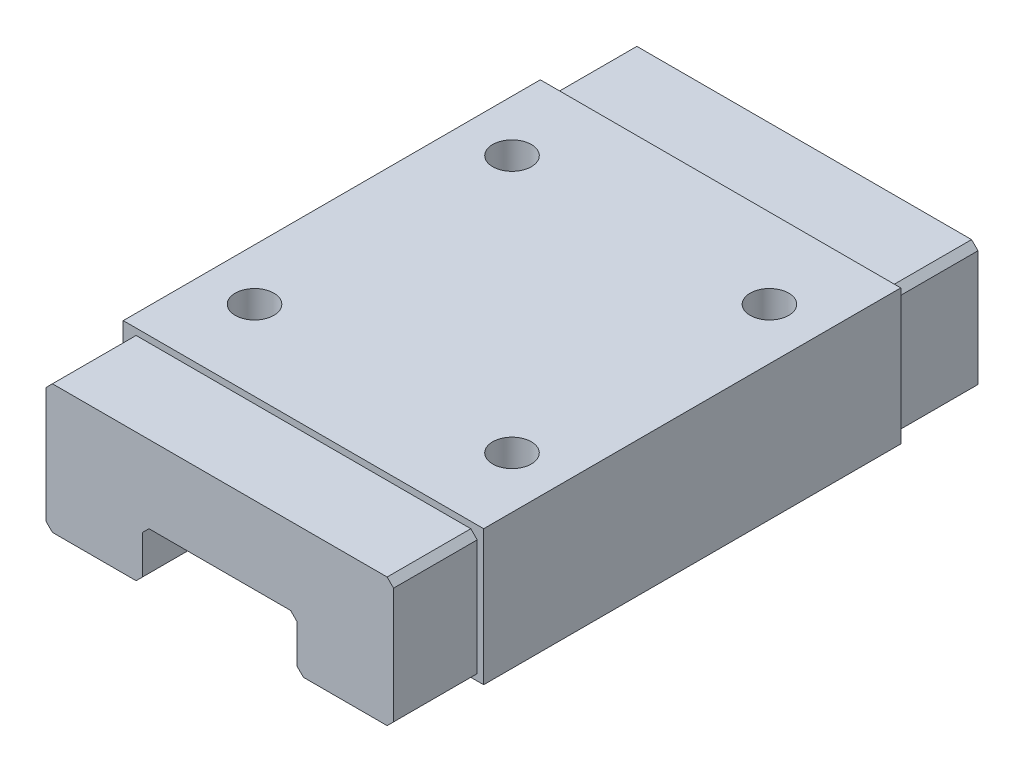
from build123d import *

# Parameters (mm, degrees)
EXTRUDE_1_DEPTH     = 45.4
EXTRUDE_START       = -6.5
EXTRUDE_2_DEPTH     = 32.4
CHAMFER_1_SIZE      = 0.5
SKETCH_3_R          = 1.5
CUT_EXTRUDE_1_DEPTH = 3.5


with BuildPart() as part:
    # 草图1 → 凸台-拉伸1 (new body)
    with BuildSketch(Plane.XY):
        Polygon((-13.5, 0), (13.5, 0), (13.5, -10), (6, -10), (6, -6), (-6, -6), (-6, -10), (-13.5, -10), align=None)
    extrude(amount=EXTRUDE_1_DEPTH)

    # 草图2 → 凸台-拉伸2 (add)
    with BuildSketch(Plane.XY.offset(45.4).offset(EXTRUDE_START)):
        Polygon((14, -10), (14, 0.5), (-14, 0.5), (-14, -10), (-13.5, -10), (-13.5, 0), (13.5, 0), (13.5, -10), align=None)
    extrude(amount=-EXTRUDE_2_DEPTH)

    # 倒角1
    chamfer_1_edges = [part.edges().sort_by_distance(p)[0] for p in [
        (13.5, -10, 42.15),
        (6, -10, 22.7),
        (6, -6, 22.7),
        (-6, -6, 22.7),
        (-6, -10, 22.7),
        (-13.5, -10, 42.15),
        (-13.5, 0, 42.15),
        (13.5, 0, 42.15),
        (13.5, -10, 3.25),
        (-13.5, -10, 3.25),
        (-13.5, 0, 3.25),
        (13.5, 0, 3.25),
    ]]
    chamfer(chamfer_1_edges, length=CHAMFER_1_SIZE)

    # 草图3 → 切除-拉伸1 (cut)
    with BuildSketch(Plane(origin=(0, 0.5, 0), x_dir=(1, 0, 0), z_dir=(0, 1, 0))):
        with Locations(Location((10, -12.7, 0), (0, 0, 270))):
            Circle(SKETCH_3_R)
        with Locations(Location((10, -32.7, 0), (0, 0, 90))):
            Circle(SKETCH_3_R)
        with Locations(Location((-10, -32.7, 0), (0, 0, 270))):
            Circle(SKETCH_3_R)
        with Locations(Location((-10, -12.7, 0), (0, 0, 90))):
            Circle(SKETCH_3_R)
    extrude(amount=-CUT_EXTRUDE_1_DEPTH, mode=Mode.SUBTRACT)


solid = part.part
